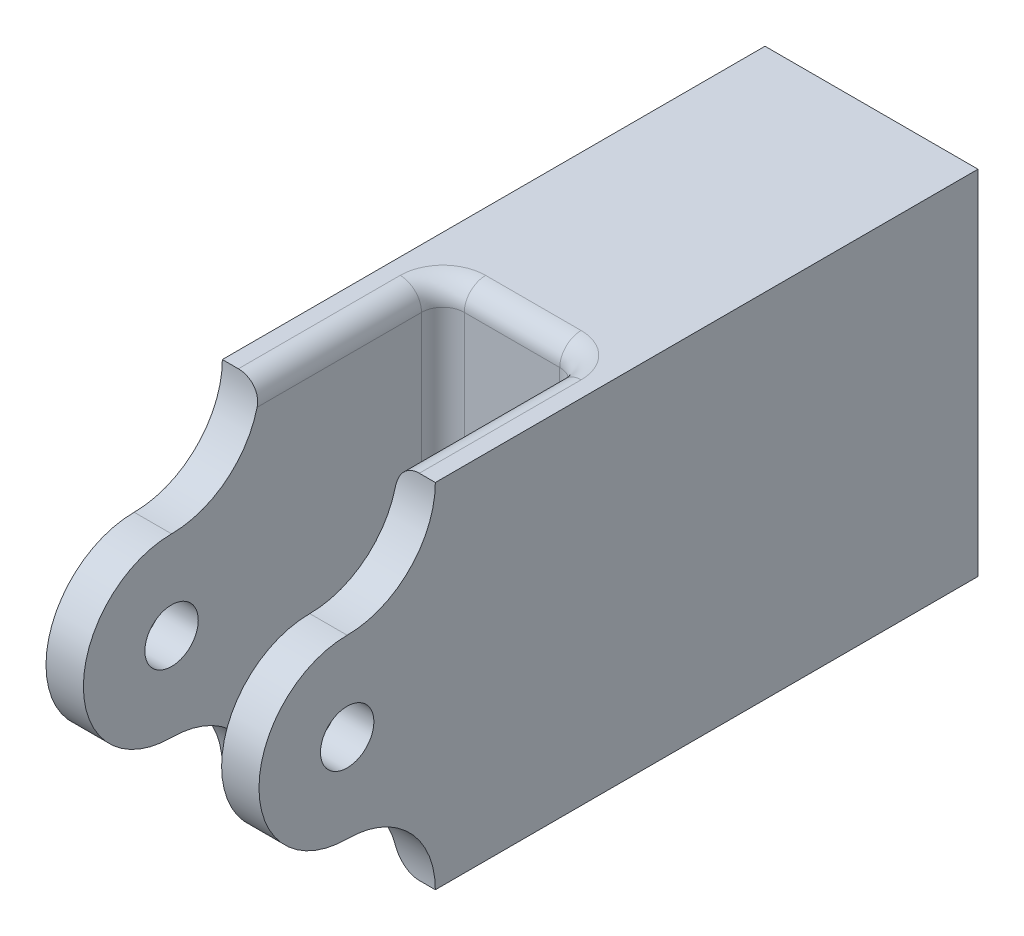
from build123d import *

# Parameters (mm, degrees)
SKETCH2_R               = 5
BOSS_EXTRUDE1_DEPTH     = 19.939
CUT_EXTRUDE1_DEPTH      = 141.037239765
CUT_EXTRUDE1_DEPTH_BACK = 141.037239765
SKETCH3_W               = 25.878
SKETCH3_H               = 67.31
FILLET1_R               = 4


with BuildPart() as part:
    # Sketch2 → Boss-Extrude1 (new, symmetric)
    with BuildSketch(Plane.YZ):
        with BuildLine():
            Line((-33.02, 0), (33.02, 0))
            Line((33.02, 0), (33.02, 101.6))
            ThreePointArc((33.02, 101.6), (21.345667043, 106.435667043), (16.51, 118.11))
            ThreePointArc((16.51, 118.11), (0, 134.62), (-16.51, 118.11))
            ThreePointArc((-16.51, 118.11), (-21.345667043, 106.435667043), (-33.02, 101.6))
            Line((-33.02, 101.6), (-33.02, 0))
        make_face()
        with Locations(Location((0, 118.11, 0), (0, 0, 270))):
            Circle(SKETCH2_R, mode=Mode.SUBTRACT)
    extrude(amount=BOSS_EXTRUDE1_DEPTH, both=True)

    # Sketch3 → Cut-Extrude1 (cut, two sides: drawn at the far end of the back side and taken through both)
    with BuildSketch(Plane(origin=(0, 0, 0), x_dir=(-1, 0, 0), z_dir=(0, 1, 0)).offset(-CUT_EXTRUDE1_DEPTH_BACK)):
        with Locations((0, 100.965)):
            Rectangle(SKETCH3_W, SKETCH3_H)
    extrude(amount=CUT_EXTRUDE1_DEPTH + CUT_EXTRUDE1_DEPTH_BACK, mode=Mode.SUBTRACT)

    # Fillet1
    fillet1_edges = [part.edges().sort_by_distance(p)[0] for p in [
        (12.939, 33.02, 84.455),
        (-12.939, -33.02, 84.455),
        (0, -33.02, 67.31),
        (-12.939, 33.02, 84.455),
        (12.939, -33.02, 84.455),
        (12.939, 0, 67.31),
        (-12.939, 0, 67.31),
        (0, 33.02, 67.31),
    ]]
    fillet(fillet1_edges, radius=FILLET1_R)


solid = part.part
